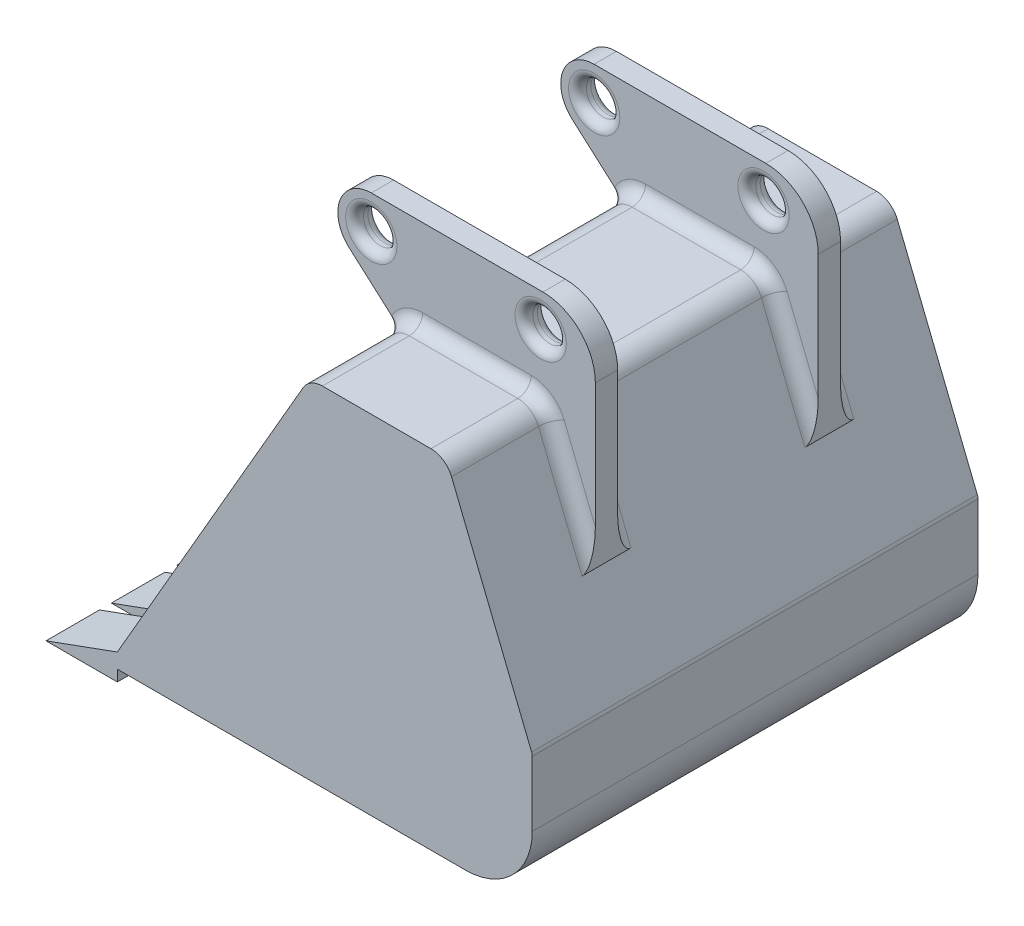
from build123d import *

# Parameters (mm, degrees)
BOSS_EXTRUDE1_DEPTH = 1000
SHELL1_T            = -35
FILLET1_R           = 20
FILLET2_R           = 50
BOSS_EXTRUDE2_DEPTH = 120
LPATTERN1_COUNT     = 7
LPATTERN1_PITCH     = 146.6
BOSS_EXTRUDE3_DEPTH = 25
SKETCH4_R           = 37.5
CUT_EXTRUDE1_DEPTH  = 1478.48993801
FILLET3_R           = 50
FILLET4_R           = 20
FILLET5_R           = 30


with BuildPart() as part:
    # Sketch1 → Boss-Extrude1 (new body)
    with BuildSketch(Plane.XY):
        with BuildLine():
            Line((0, -150), (-800, -150))
            Line((-800, -150), (-349.666790032, 630))
            Line((-349.666790032, 630), (-43.666790032, 630))
            Line((-43.666790032, 630), (150, 150))
            Line((150, 150), (150, 0))
            ThreePointArc((150, 0), (106.066017178, -106.066017178), (0, -150))
        make_face()
    extrude(amount=BOSS_EXTRUDE1_DEPTH)

    # Shell1
    shell1_openings = [part.faces().sort_by_distance(p)[0] for p in [
        (-574.833395016, 240, 500),
    ]]
    offset(amount=SHELL1_T, openings=shell1_openings, kind=Kind.INTERSECTION)

    # Fillet1
    fillet1_edges = [part.edges().sort_by_distance(p)[0] for p in [
        (150, 150, 500),
    ]]
    fillet(fillet1_edges, radius=FILLET1_R)

    # Fillet2
    fillet2_edges = [part.edges().sort_by_distance(p)[0] for p in [
        (-43.666790032, 630, 500),
    ]]
    fillet(fillet2_edges, radius=FILLET2_R)

    # Sketch2 → Boss-Extrude2 (add)
    with BuildSketch(Plane.XY.offset(1000)):
        Polygon((-780.811626693, -116.764762517), (-780.811626693, -175), (-940.811626693, -175), align=None)
    boss_extrude2 = extrude(amount=-BOSS_EXTRUDE2_DEPTH)

    # LPattern1: Boss-Extrude2 ×7
    with Locations(*[(0, 0, -i * LPATTERN1_PITCH) for i in range(1, LPATTERN1_COUNT)]):
        add(boss_extrude2)

    # Sketch3 → Boss-Extrude3 (add, symmetric)
    with BuildSketch(Plane.XY.offset(250)):
        with BuildLine():
            Line((-436.075310487, 835), (-51.075310487, 835))
            ThreePointArc((-51.075310487, 835), (32.126955534, 800.536492994), (66.590462541, 717.334226972))
            Line((66.590462541, 717.334226972), (66.590462541, 356.729186629))
            Line((66.590462541, 356.729186629), (-31.041431899, 598.708254508))
            ThreePointArc((-31.041431899, 598.708254508), (-49.44002482, 621.445221229), (-77.409537459, 630))
            Line((-77.409537459, 630), (-349.666790032, 630))
            Line((-349.666790032, 630), (-367.593343938, 598.95029783))
            Line((-367.593343938, 598.95029783), (-485.857605126, 703.904339378))
            ThreePointArc((-485.857605126, 703.904339378), (-506.190125422, 786.625415052), (-436.075310487, 835))
        make_face()
    boss_extrude3 = extrude(amount=BOSS_EXTRUDE3_DEPTH, both=True)

    # Mirror1: Boss-Extrude3 across plane
    add(boss_extrude3.mirror(Plane.XY.offset(500)))

    # Sketch4 → Cut-Extrude1 (cut, through all)
    with BuildSketch(Plane.XY.offset(775)):
        with Locations((-436.075310487, 760)):
            Circle(SKETCH4_R)
        with Locations((-56.075310487, 760)):
            Circle(SKETCH4_R)
    extrude(amount=-CUT_EXTRUDE1_DEPTH, mode=Mode.SUBTRACT)

    # Fillet3
    fillet3_edges = [part.edges().sort_by_distance(p)[0] for p in [
        (-349.666790032, 630, 887.5),
        (-349.666790032, 630, 112.5),
        (-349.666790032, 630, 500),
    ]]
    fillet(fillet3_edges, radius=FILLET3_R)

    # Fillet4
    fillet4_edges = [part.edges().sort_by_distance(p)[0] for p in [
        (-473.575310487, 760, 725),
        (-473.575310487, 760, 275),
        (-473.575310487, 760, 225),
        (-473.575310487, 760, 775),
        (-93.575310487, 760, 725),
        (-93.575310487, 760, 275),
        (-93.575310487, 760, 225),
        (-93.575310487, 760, 775),
    ]]
    fillet(fillet4_edges, radius=FILLET4_R)

    # Fillet5
    fillet5_edges = [part.edges().sort_by_distance(p)[0] for p in [
        (-199.104407016, 630, 275),
        (-49.44002482, 621.445221229, 275),
        (17.774515321, 477.718720569, 275),
        (17.774515321, 477.718720569, 225),
        (-49.44002482, 621.445221229, 225),
        (-199.104407016, 630, 225),
        (17.774515321, 477.718720569, 775),
        (-49.44002482, 621.445221229, 775),
        (-199.104407016, 630, 775),
        (17.774515321, 477.718720569, 725),
        (-49.44002482, 621.445221229, 725),
        (-199.104407016, 630, 725),
        (-365.84694535, 601.975148915, 725),
        (-365.84694535, 601.975148915, 275),
        (-365.84694535, 601.975148915, 225),
        (-365.84694535, 601.975148915, 775),
        (-345.799276573, 623.301270189, 225),
        (-345.799276573, 623.301270189, 775),
        (-345.799276573, 623.301270189, 275),
        (-345.799276573, 623.301270189, 725),
    ]]
    fillet(fillet5_edges, radius=FILLET5_R)


solid = part.part
